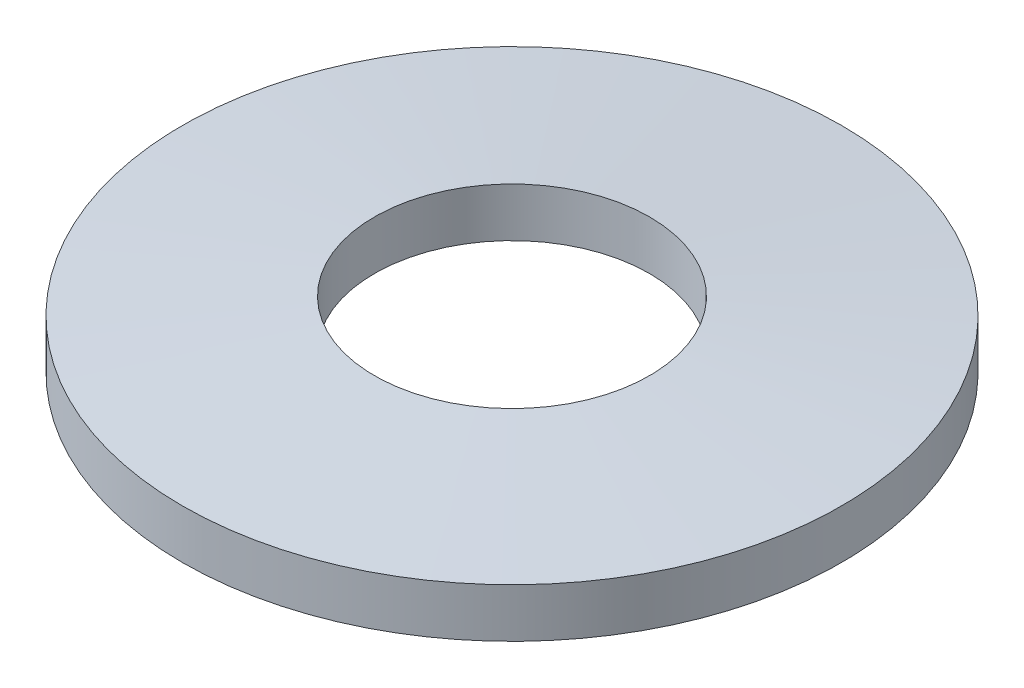
from build123d import *


with BuildPart() as part:
    # Sketch1 → Revolve1 (revolve)
    with BuildSketch(Plane.XY):
        Polygon((2.5019, 1.197949993), (2.5019, 0.305554157), (5.9944, 0), (5.9944, 0.892395836), align=None)
    revolve(axis=Axis((0, 4.734053857, 0), (0, 1, 0)))


solid = part.part
